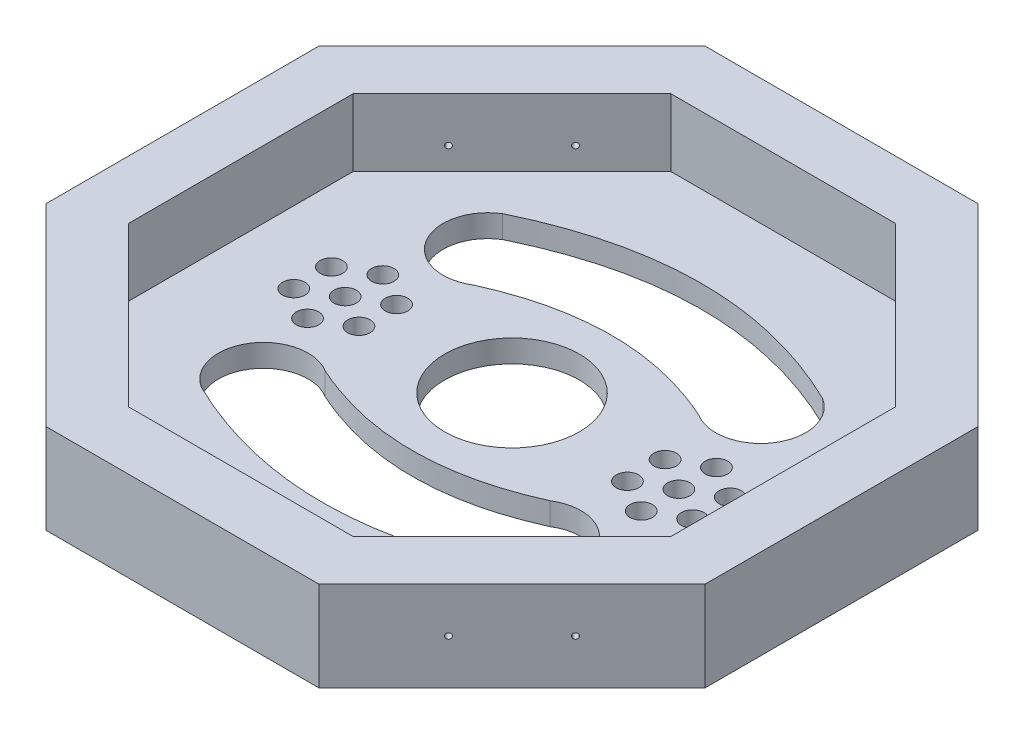
from build123d import *

# Parameters (mm, degrees)
RESSALTO_EXTRUS_O1_DEPTH                = 40
CORTE_EXTRUS_O2_START                   = -5
CORTE_EXTRUS_O2_DEPTH                   = 25
CORTE_EXTRUS_O3_DEPTH                   = 25
ESBO_O4_R                               = 30
ESBO_O4_R_2                             = 5
CORTE_EXTRUS_O4_DEPTH                   = 10
BROCA_DE_ROSQUEAR_PARA_TARRAXA_DE_M31_D = 2.5
BROCA_DE_ROSQUEAR_PARA_TARRAXA_DE_M32_D = 2.5


with BuildPart() as part:
    # Esboço1 → Ressalto-extrusão1 (new body)
    with BuildSketch(Plane(origin=(0, 0, 0), x_dir=(1, 0, 0), z_dir=(0, 1, 0))):
        Polygon((146.682207566, -60.757759733), (146.682207566, 60.757759733), (60.757759733, 146.682207566), (-60.757759733, 146.682207566), (-146.682207566, 60.757759733), (-146.682207566, -60.757759733), (-60.757759733, -146.682207566), (60.757759733, -146.682207566), align=None)
    extrude(amount=RESSALTO_EXTRUS_O1_DEPTH)

    # Esboço2 → Corte-extrusão2 (cut)
    with BuildSketch(Plane(origin=(0, 40, 0), x_dir=(1, 0, 0), z_dir=(0, 1, 0)).offset(CORTE_EXTRUS_O2_START)):
        Polygon((120.710678119, 50), (50, 120.710678119), (-50, 120.710678119), (-120.710678119, 50), (-120.710678119, -50), (-50, -120.710678119), (50, -120.710678119), (120.710678119, -50), align=None)
    extrude(amount=-CORTE_EXTRUS_O2_DEPTH, mode=Mode.SUBTRACT)

    # Esboço3 → Corte-extrusão3 (cut)
    with BuildSketch(Plane(origin=(0, 40, 0), x_dir=(1, 0, 0), z_dir=(0, 1, 0))):
        Polygon((120.710678119, 50), (50, 120.710678119), (-50, 120.710678119), (-120.710678119, 50), (-120.710678119, -50), (-50, -120.710678119), (50, -120.710678119), (120.710678119, -50), align=None)
    extrude(amount=-CORTE_EXTRUS_O3_DEPTH, mode=Mode.SUBTRACT)

    # Esboço4 → Corte-extrusão4 (cut)
    with BuildSketch(Plane(origin=(0, 10, 0), x_dir=(1, 0, 0), z_dir=(0, 1, 0))):
        with Locations(Location((0, 0, 0), (0, 0, 270))):
            Circle(ESBO_O4_R)
        with Locations(Location((-74.266400318, 16.749004229, 0), (0, 0, 270))):
            Circle(ESBO_O4_R_2)
        with Locations(Location((-59.761337168, 8.374502115, 0), (0, 0, 270))):
            Circle(ESBO_O4_R_2)
        with Locations(Location((-59.761337168, -8.374502115, 0), (0, 0, 270))):
            Circle(ESBO_O4_R_2)
        with Locations(Location((-74.266400318, -16.749004229, 0), (0, 0, 270))):
            Circle(ESBO_O4_R_2)
        with Locations(Location((-88.771463469, -8.374502115, 0), (0, 0, 270))):
            Circle(ESBO_O4_R_2)
        with Locations(Location((-88.771463469, 8.374502115, 0), (0, 0, 270))):
            Circle(ESBO_O4_R_2)
        with Locations(Location((-74.266400318, 0, 0), (0, 0, 270))):
            Circle(ESBO_O4_R_2)
        with Locations(Location((74.266400318, 0, 0), (0, 0, 90))):
            Circle(ESBO_O4_R_2)
        with Locations(Location((88.771463469, 8.374502115, 0), (0, 0, 90))):
            Circle(ESBO_O4_R_2)
        with Locations(Location((88.771463469, -8.374502115, 0), (0, 0, 90))):
            Circle(ESBO_O4_R_2)
        with Locations(Location((74.266400318, -16.749004229, 0), (0, 0, 90))):
            Circle(ESBO_O4_R_2)
        with Locations(Location((59.761337168, -8.374502115, 0), (0, 0, 90))):
            Circle(ESBO_O4_R_2)
        with Locations(Location((59.761337168, 8.374502115, 0), (0, 0, 90))):
            Circle(ESBO_O4_R_2)
        with Locations(Location((74.266400318, 16.749004229, 0), (0, 0, 90))):
            Circle(ESBO_O4_R_2)
        with BuildLine():
            ThreePointArc((-71.17306789, 67.045187012), (-77.704390833, 39.454208035), (-50.081737205, 33.058169667))
            add(Edge.make_bspline(
                [(-50.081737205, 33.058169667), (0, 55.749902863), (50.081737205, 33.058169667)],
                knots=[0, 0, 0, 1, 1, 1], degree=2))
            ThreePointArc((50.081737205, 33.058169667), (77.704390833, 39.454208035), (71.17306789, 67.045187012))
            add(Edge.make_bspline(
                [(-71.17306789, 67.045187012), (0, 101.762885517), (71.17306789, 67.045187012)],
                knots=[0, 0, 0, 1, 1, 1], degree=2))
        make_face()
        with BuildLine():
            ThreePointArc((-71.17306789, -67.045187012), (-77.704390833, -39.454208035), (-50.081737205, -33.058169667))
            add(Edge.make_bspline(
                [(-50.081737205, -33.058169667), (0, -55.749902863), (50.081737205, -33.058169667)],
                knots=[0, 0, 0, 1, 1, 1], degree=2))
            ThreePointArc((50.081737205, -33.058169667), (77.704390833, -39.454208035), (71.17306789, -67.045187012))
            add(Edge.make_bspline(
                [(-71.17306789, -67.045187012), (0, -101.762885517), (71.17306789, -67.045187012)],
                knots=[0, 0, 0, 1, 1, 1], degree=2))
        make_face()
    extrude(amount=-CORTE_EXTRUS_O4_DEPTH, mode=Mode.SUBTRACT)

    # Broca de rosquear para tarraxa de M31 (through all)
    with Locations(Plane(origin=(103.719983649, 0, 103.719983649), x_dir=(0.7071067811865479, 0, -0.7071067811865472), z_dir=(0.7071067811865472, 0, 0.7071067811865479))):
        with Locations((-20, 20), (20, 20)):
            Hole(BROCA_DE_ROSQUEAR_PARA_TARRAXA_DE_M31_D / 2)

    # Broca de rosquear para tarraxa de M32 (through all)
    with Locations(Plane(origin=(-103.719983649, 0, 103.719983649), x_dir=(0.7071067811865476, 0, 0.7071067811865476), z_dir=(-0.7071067811865476, 0, 0.7071067811865476))):
        with Locations((-20, 20), (20, 20)):
            Hole(BROCA_DE_ROSQUEAR_PARA_TARRAXA_DE_M32_D / 2)


solid = part.part
